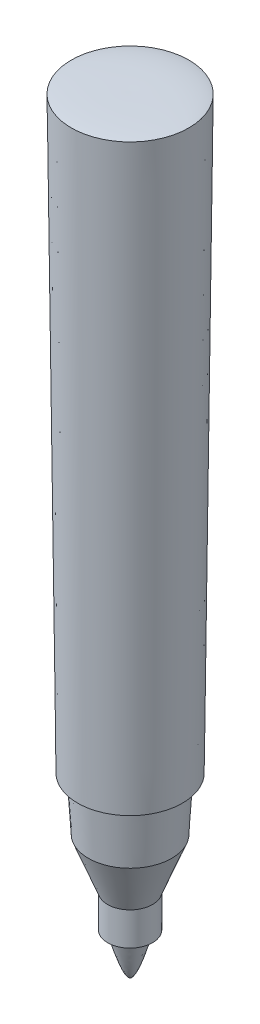
from build123d import *


with BuildPart() as part:
    # Sketch1 → Revolve1 (revolve)
    with BuildSketch(Plane.XY, mode=Mode.PRIVATE) as revolve1_sk:
        with BuildLine():
            Line((0, 0), (0, 130))
            add(Edge.make_bspline(
                [(0, 130), (7.444716878, 130.087394751), (9.95, 129.5)],
                knots=[0, 0, 0, 1, 1, 1], degree=2))
            Line((9.95, 129.5), (8.875, 30))
            Line((8.875, 30), (7.6, 30))
            Line((7.6, 30), (7.05, 21))
            Line((7.05, 21), (3.8, 12.6))
            Line((3.8, 12.6), (3.8, 7))
            Line((3.8, 7), (2.8, 7))
            add(Edge.make_bspline(
                [(0, 0), (0.934954865, 0.032949741), (2.8, 7)],
                knots=[0, 0, 0, 1, 1, 1], degree=2))
        make_face()
    revolve(revolve1_sk.sketch.rotate(Axis((0, 0, 0), (0, 1, 0)), 90), axis=Axis((0, 0, 0), (0, 1, 0)))


solid = part.part
